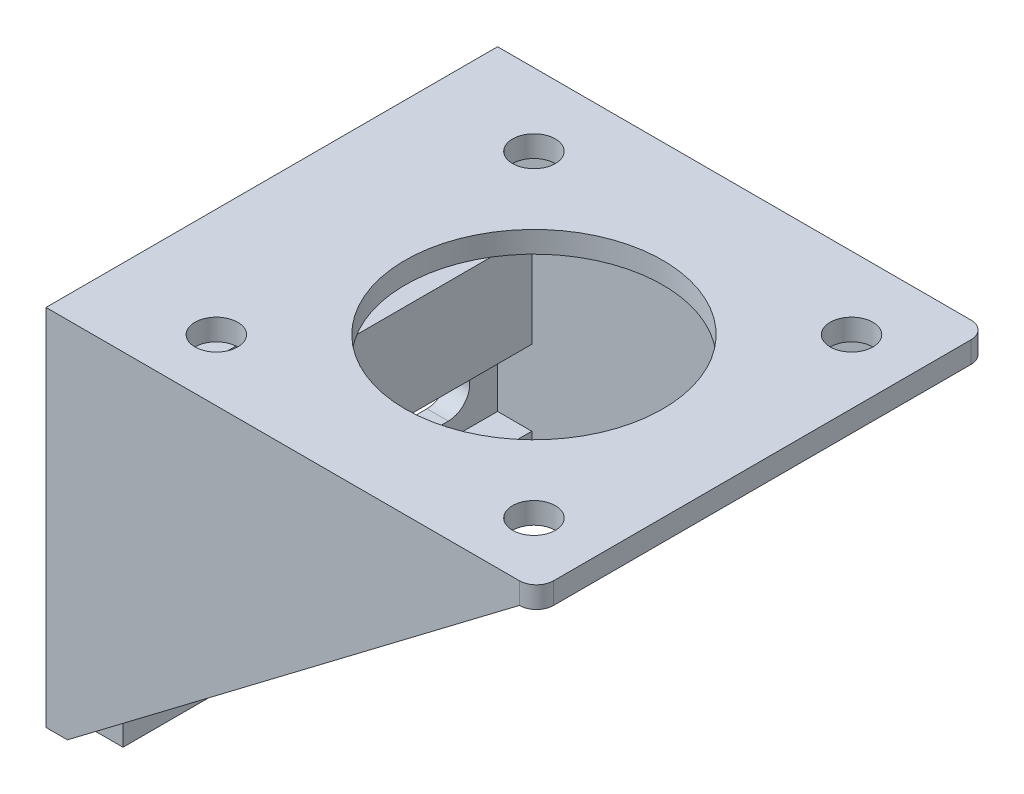
from build123d import *

# Parameters (mm, degrees)
SKETCH1_W           = 72.771
SKETCH1_H           = 66.9925
SKETCH1_R           = 19.1135
SKETCH1_R_2         = 3.175
BOSS_EXTRUDE1_DEPTH = 3.175
FILLET1_R           = 2.54
SKETCH2_W           = 66.9925
SKETCH2_H           = 50.8
BOSS_EXTRUDE2_DEPTH = 3.175
BOSS_EXTRUDE5_DEPTH = 3.175
BOSS_EXTRUDE6_DEPTH = 3.175
SKETCH9_R           = 3.175
CUT_EXTRUDE1_DEPTH  = 3.175
BOSS_EXTRUDE7_DEPTH = 5.08


with BuildPart() as part:
    # Sketch1 → Boss-Extrude1 (new body)
    with BuildSketch(Plane(origin=(0, 0, 0), x_dir=(1, 0, 0), z_dir=(0, 1, 0))):
        with Locations((-3.302, 0.79375)):
            Rectangle(SKETCH1_W, SKETCH1_H)
        with Locations(Location((0, 0, 0), (0, 0, 270))):
            Circle(SKETCH1_R, mode=Mode.SUBTRACT)
        with Locations(Location((-23.5585, 23.5585, 0), (0, 0, 270))):
            Circle(SKETCH1_R_2, mode=Mode.SUBTRACT)
        with Locations(Location((23.5585, 23.5585, 0), (0, 0, 270))):
            Circle(SKETCH1_R_2, mode=Mode.SUBTRACT)
        with Locations(Location((23.5585, -23.5585, 0), (0, 0, 270))):
            Circle(SKETCH1_R_2, mode=Mode.SUBTRACT)
        with Locations(Location((-23.5585, -23.5585, 0), (0, 0, 270))):
            Circle(SKETCH1_R_2, mode=Mode.SUBTRACT)
    extrude(amount=BOSS_EXTRUDE1_DEPTH)

    # Fillet1
    fillet1_edges = [part.edges().sort_by_distance(p)[0] for p in [
        (33.0835, 1.5875, -34.29),
        (33.0835, 1.5875, 32.7025),
    ]]
    fillet(fillet1_edges, radius=FILLET1_R)

    # Sketch2 → Boss-Extrude2 (add)
    with BuildSketch(Plane.ZY.offset(39.6875)):
        with Locations((-0.79375, -25.4)):
            Rectangle(SKETCH2_W, SKETCH2_H)
    extrude(amount=-BOSS_EXTRUDE2_DEPTH)

    # Sketch7 → Boss-Extrude5 (add)
    with BuildSketch(Plane.XY.offset(32.7025)):
        Polygon((-36.5125, -50.8), (30.5435, 0), (-36.5125, 0), align=None)
    extrude(amount=-BOSS_EXTRUDE5_DEPTH)

    # Sketch8 → Boss-Extrude6 (add)
    with BuildSketch(Plane(origin=(0, 0, -34.29), x_dir=(-1, 0, 0), z_dir=(0, 0, -1))):
        Polygon((-30.5435, 0), (36.5125, 0), (36.5125, -50.8), align=None)
    extrude(amount=-BOSS_EXTRUDE6_DEPTH)

    # Sketch9 → Cut-Extrude1 (cut)
    with BuildSketch(Plane(origin=(-36.5125, 0, 0), x_dir=(0, 0, -1), z_dir=(1, 0, 0))):
        with BuildLine():
            ThreePointArc((-2.2225, -12.7), (-5.3975, -9.525), (-2.2225, -6.35))
            Line((-2.2225, -6.35), (-12.3825, -6.35))
            ThreePointArc((-12.3825, -6.35), (-10.13743597, -7.27993597), (-9.2075, -9.525))
            ThreePointArc((-9.2075, -9.525), (-10.13743597, -11.77006403), (-12.3825, -12.7))
            Line((-12.3825, -12.7), (-2.2225, -12.7))
        make_face()
        with Locations((-2.2225, -9.525)):
            Circle(SKETCH9_R)
        with Locations((-12.3825, -9.525)):
            Circle(SKETCH9_R)
        with BuildLine():
            ThreePointArc((23.8125, -12.7), (20.6375, -9.525), (23.8125, -6.35))
            Line((23.8125, -6.35), (13.6525, -6.35))
            ThreePointArc((13.6525, -6.35), (15.89756403, -7.27993597), (16.8275, -9.525))
            ThreePointArc((16.8275, -9.525), (15.89756403, -11.77006403), (13.6525, -12.7))
            Line((13.6525, -12.7), (23.8125, -12.7))
        make_face()
        with Locations((13.6525, -9.525)):
            Circle(SKETCH9_R)
        with Locations((23.8125, -9.525)):
            Circle(SKETCH9_R)
        with Locations((23.8125, -34.925)):
            Circle(SKETCH9_R)
        with BuildLine():
            Line((13.6525, -38.1), (23.8125, -38.1))
            ThreePointArc((23.8125, -38.1), (20.6375, -34.925), (23.8125, -31.75))
            Line((23.8125, -31.75), (13.6525, -31.75))
            ThreePointArc((13.6525, -31.75), (15.89756403, -32.67993597), (16.8275, -34.925))
            ThreePointArc((16.8275, -34.925), (15.89756403, -37.17006403), (13.6525, -38.1))
        make_face()
        with Locations((13.6525, -34.925)):
            Circle(SKETCH9_R)
        with Locations((-2.2225, -34.925)):
            Circle(SKETCH9_R)
        with BuildLine():
            ThreePointArc((-2.2225, -38.1), (-5.3975, -34.925), (-2.2225, -31.75))
            Line((-2.2225, -31.75), (-12.3825, -31.75))
            ThreePointArc((-12.3825, -31.75), (-10.13743597, -32.67993597), (-9.2075, -34.925))
            ThreePointArc((-9.2075, -34.925), (-10.13743597, -37.17006403), (-12.3825, -38.1))
            Line((-12.3825, -38.1), (-2.2225, -38.1))
        make_face()
        with Locations((-12.3825, -34.925)):
            Circle(SKETCH9_R)
    extrude(amount=-CUT_EXTRUDE1_DEPTH, mode=Mode.SUBTRACT)

    # Sketch10 → Boss-Extrude7 (add)
    with BuildSketch(Plane(origin=(-36.5125, 0, 0), x_dir=(0, 0, -1), z_dir=(1, 0, 0))):
        Polygon((23.8125, -15.113), (-29.5275, -15.113), (-29.5275, -29.337), (23.8125, -29.337), (31.115, -29.337), (31.115, -15.113), align=None)
        Polygon((31.115, 0), (-29.5275, 0), (-29.5275, -3.937), (23.8125, -3.937), (31.115, -3.937), align=None)
        Polygon((23.8125, -40.513), (-29.5275, -40.513), (-29.5275, -50.8), (31.115, -50.8), (31.115, -40.513), align=None)
    extrude(amount=BOSS_EXTRUDE7_DEPTH)


solid = part.part
